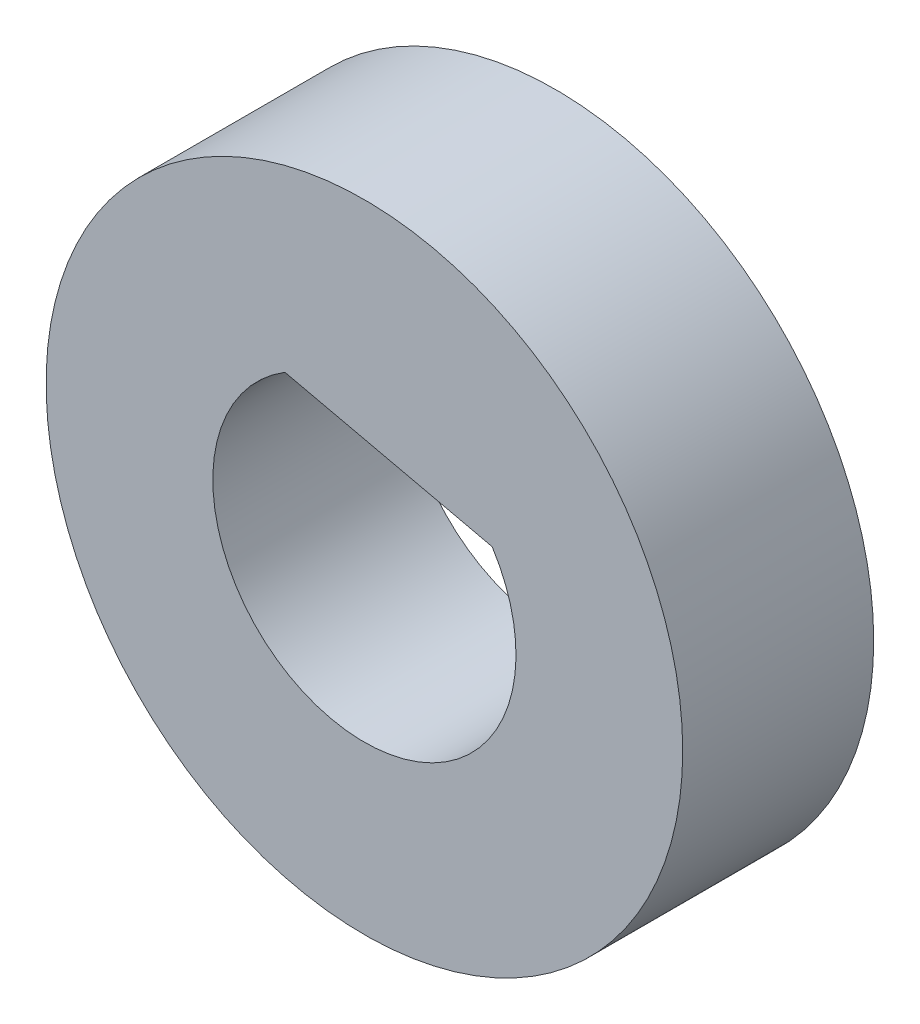
from build123d import *

# Parameters (mm, degrees)
SKETCH1_R           = 5
BOSS_EXTRUDE1_DEPTH = 3
CUT_EXTRUDE1_DEPTH  = 3


with BuildPart() as part:
    # Sketch1 → Boss-Extrude1 (new body)
    with BuildSketch(Plane.XY):
        Circle(SKETCH1_R)
    extrude(amount=BOSS_EXTRUDE1_DEPTH)

    # Sketch2 → Cut-Extrude1 (cut)
    with BuildSketch(Plane.XY.offset(3)):
        with BuildLine():
            Line((-1.249238699, 2.027252879), (2.006668261, 1.282042922))
            ThreePointArc((2.006668261, 1.282042922), (-0.531280863, -2.321226445), (-1.249238699, 2.027252879))
        make_face()
    extrude(amount=-CUT_EXTRUDE1_DEPTH, mode=Mode.SUBTRACT)


solid = part.part
